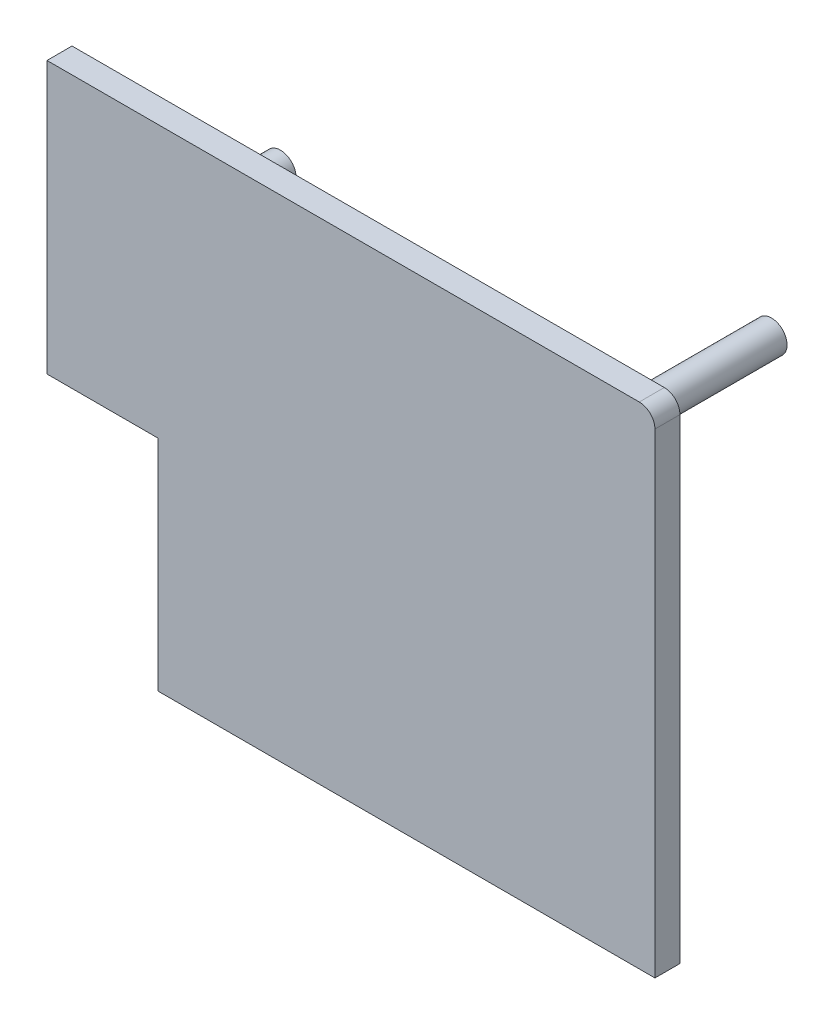
from build123d import *

# Parameters (mm, degrees)
BOSS_EXTRUDE1_DEPTH = 1.6
SKETCH5_R           = 1
BOSS_EXTRUDE2_DEPTH = 9


with BuildPart() as part:
    # Sketch4 → Boss-Extrude1 (new body)
    with BuildSketch(Plane.XY):
        with BuildLine():
            Line((214.083314686, -91.426205385), (214.083314686, -108.78795934))
            Line((214.083314686, -108.78795934), (221.166748687, -108.78795934))
            Line((221.166748687, -108.78795934), (221.166748687, -122.793871773))
            Line((221.166748687, -122.793871773), (252.95, -122.793871773))
            Line((252.95, -122.793871773), (252.95, -92.4019243))
            ThreePointArc((252.95, -92.4019243), (252.656880102, -91.694590841), (251.949358863, -91.401924489))
            Line((251.949358863, -91.401924489), (214.083314686, -91.426205385))
        make_face()
    extrude(amount=BOSS_EXTRUDE1_DEPTH)

    # Sketch5 → Boss-Extrude2 (add)
    with BuildSketch(Plane(origin=(0, 0, 0), x_dir=(-1, 0, 0), z_dir=(0, 0, -1))):
        with Locations((-224.853507667, -120.53205767)):
            Circle(SKETCH5_R)
        with Locations((-218.408459116, -100.527296583)):
            Circle(SKETCH5_R)
        with Locations((-241.552042549, -120.53205767)):
            Circle(SKETCH5_R)
        with Locations((-249.796682579, -94.124098997)):
            Circle(SKETCH5_R)
    extrude(amount=BOSS_EXTRUDE2_DEPTH)


solid = part.part
